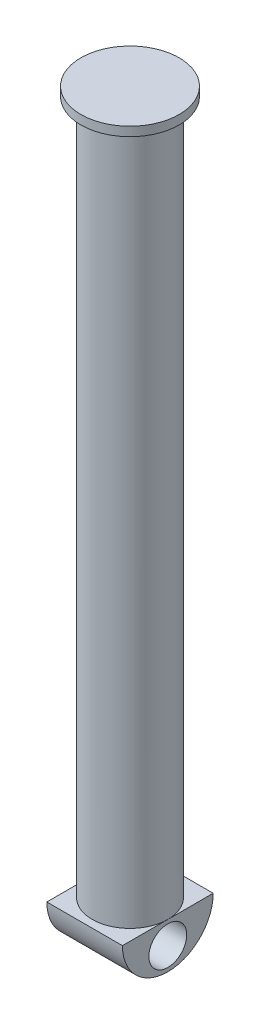
from build123d import *

# Parameters (mm, degrees)
CROQUIS1_R                   = 13
SALIENTE_EXTRUIR1_DEPTH      = 2.4
CROQUIS2_R                   = 10
SALIENTE_EXTRUIR2_DEPTH      = 183.48
SALIENTE_EXTRUIR3_DEPTH      = 10
SALIENTE_EXTRUIR3_DEPTH_BACK = 10
CROQUIS3_R                   = 5


with BuildPart() as part:
    # Croquis1 → Saliente-Extruir1 (new body)
    with BuildSketch(Plane(origin=(0, 0, 0), x_dir=(1, 0, 0), z_dir=(0, 1, 0))):
        Circle(CROQUIS1_R)
    extrude(amount=SALIENTE_EXTRUIR1_DEPTH)

    # Croquis2 → Saliente-Extruir2 (add)
    with BuildSketch(Plane.XZ):
        Circle(CROQUIS2_R)
    extrude(amount=SALIENTE_EXTRUIR2_DEPTH)

    # Croquis3 → Saliente-Extruir3 (add, two sides: drawn at the far end of the back side and taken through both)
    with BuildSketch(Plane(origin=(0, 0, 0), x_dir=(0, 0, -1), z_dir=(1, 0, 0)).offset(-SALIENTE_EXTRUIR3_DEPTH_BACK)):
        with BuildLine():
            Line((-12, -183.48), (12, -183.48))
            ThreePointArc((12, -183.48), (0, -195.48), (-12, -183.48))
        make_face()
        with Locations((0, -189.48)):
            Circle(CROQUIS3_R, mode=Mode.SUBTRACT)
    extrude(amount=SALIENTE_EXTRUIR3_DEPTH + SALIENTE_EXTRUIR3_DEPTH_BACK)


solid = part.part
